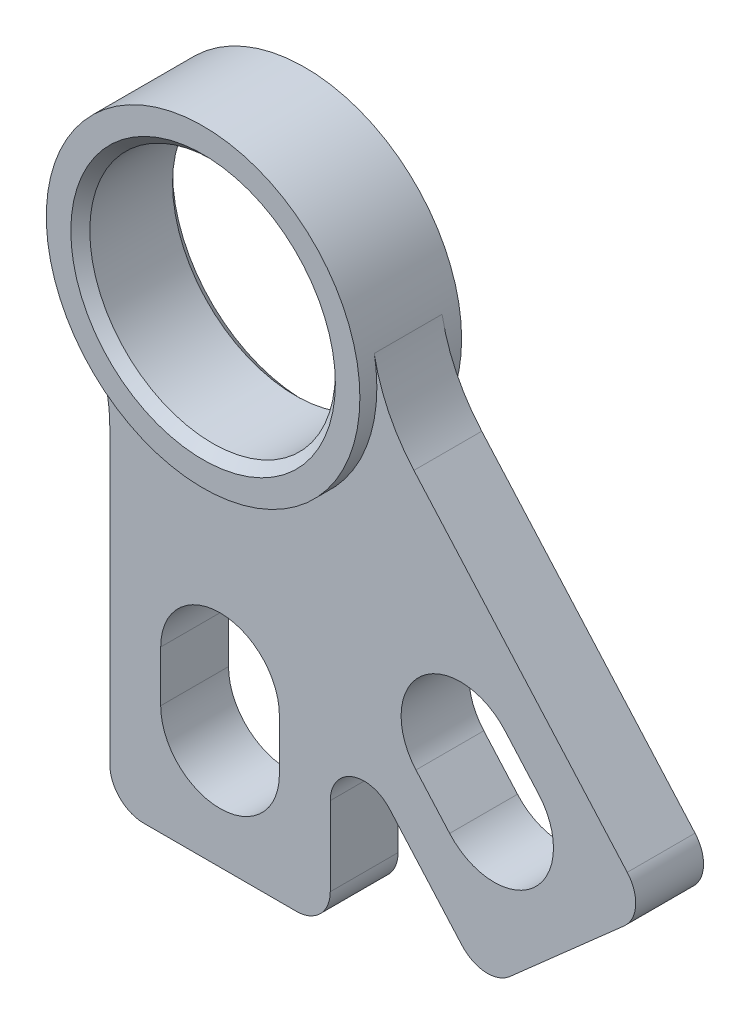
from build123d import *

# Parameters (mm, degrees)
SKETCH1_R           = 11.495405
BOSS_EXTRUDE2_DEPTH = 4.7625
BOSS_EXTRUDE3_DEPTH = 3.175
FILLET1_R           = 3.175
CHAMFER1_SIZE       = 0.889


with BuildPart() as part:
    # Sketch1 → Boss-Extrude2 (new, symmetric)
    with BuildSketch(Plane.XY):
        with BuildLine():
            ThreePointArc((14.43672871, 2.668051275), (-5.197044393, 13.730563099), (-12.585193267, -7.559797873))
            ThreePointArc((-12.585193267, -7.559797873), (5.197044393, -13.730563099), (14.43672871, 2.668051275))
        make_face()
        Circle(SKETCH1_R, mode=Mode.SUBTRACT)
    extrude(amount=BOSS_EXTRUDE2_DEPTH, both=True)

    # Sketch1<4> → Boss-Extrude3 (add, symmetric)
    with BuildSketch(Plane.XY):
        with BuildLine():
            ThreePointArc((-12.585193267, -7.559797873), (-10.89585042, -11.492870345), (-10.31875, -15.734319794))
            Line((-10.31875, -15.734319794), (-10.31875, -46.214319794))
            Line((-10.31875, -46.214319794), (10.31875, -46.214319794))
            Line((10.31875, -46.214319794), (10.31875, -27.262081536))
            Line((10.31875, -27.262081536), (24.759911139, -43.605812684))
            Line((24.759911139, -43.605812684), (40.225193096, -29.940840667))
            Line((40.225193096, -29.940840667), (18.15100753, -4.958462121))
            ThreePointArc((18.15100753, -4.958462121), (15.775028495, -1.397891668), (14.43672871, 2.668051275))
            ThreePointArc((14.43672871, 2.668051275), (5.197044393, -13.730563099), (-12.585193267, -7.559797873))
        make_face()
        with BuildLine():
            ThreePointArc((5.55625, -35.895569794), (0, -41.451819794), (-5.55625, -35.895569794))
            Line((-5.55625, -35.895569794), (-5.55625, -31.133069794))
            ThreePointArc((-5.55625, -31.133069794), (0, -25.576819794), (5.55625, -31.133069794))
            Line((5.55625, -31.133069794), (5.55625, -35.895569794))
        make_face(mode=Mode.SUBTRACT)
        with BuildLine():
            ThreePointArc((29.823795866, -25.361654769), (29.339097036, -33.204415455), (21.496336351, -32.719716625))
            Line((21.496336351, -32.719716625), (18.34288127, -29.150805404))
            ThreePointArc((18.34288127, -29.150805404), (18.8275801, -21.308044718), (26.670340785, -21.792743548))
            Line((26.670340785, -21.792743548), (29.823795866, -25.361654769))
        make_face(mode=Mode.SUBTRACT)
    extrude(amount=BOSS_EXTRUDE3_DEPTH, both=True)

    # Fillet1
    fillet1_edges = [part.edges().sort_by_distance(p)[0] for p in [
        (-10.31875, -46.214319794, 0),
        (40.225193096, -29.940840667, 0),
        (10.31875, -27.262081536, 0),
        (24.759911139, -43.605812684, 0),
        (10.31875, -46.214319794, 0),
    ]]
    fillet(fillet1_edges, radius=FILLET1_R)

    # Chamfer1
    chamfer1_edges = [part.edges().sort_by_distance(p)[0] for p in [
        (-11.495405, 0, 4.7625),
        (-11.495405, 0, -4.7625),
    ]]
    chamfer(chamfer1_edges, length=CHAMFER1_SIZE)


solid = part.part
